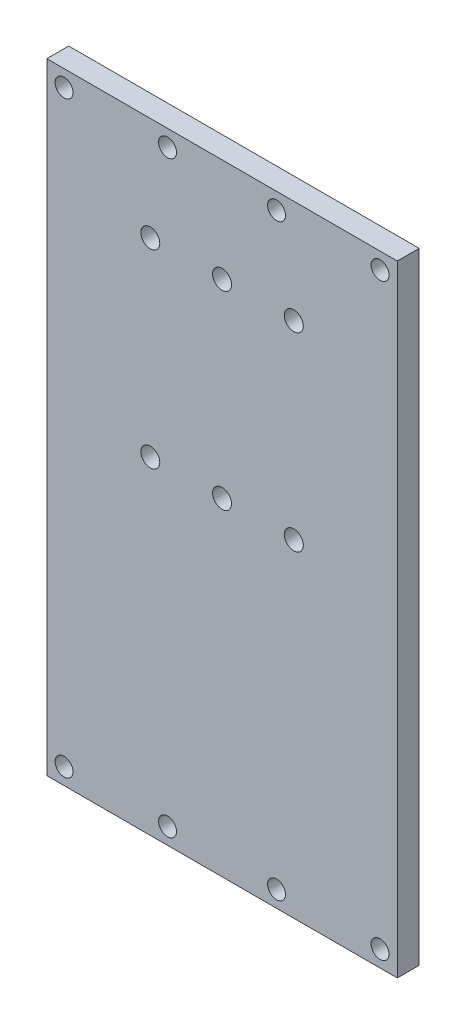
from build123d import *

# Parameters (mm, degrees)
ESBO_O1_W                = 101.6
ESBO_O1_H                = 180
RESSALTO_EXTRUS_O1_DEPTH = 6.35
CORTE_EXTRUS_O1_REACH    = 105.542
ESBO_O2_R                = 2.6
ESBO_O2_R_2              = 2.75


with BuildPart() as part:
    # Esboço1 → Ressalto-extrusão1 (new body)
    with BuildSketch(Plane.XY):
        Rectangle(ESBO_O1_W, ESBO_O1_H)
    extrude(amount=RESSALTO_EXTRUS_O1_DEPTH)

    # Esboço2 → Corte-extrusão1 (cut, up to next)
    with BuildSketch(Plane.XY.offset(6.35), mode=Mode.PRIVATE) as corte_extrus_o1_sk1:
        with Locations((-45.8, 85.24)):
            Circle(ESBO_O2_R)
    corte_extrus_o1_tool1 = extrude(corte_extrus_o1_sk1.sketch, amount=-CORTE_EXTRUS_O1_REACH, mode=Mode.PRIVATE) & part.part
    # Esboço2 → Corte-extrusão1 (cut, up to next)
    with BuildSketch(Plane.XY.offset(6.35), mode=Mode.PRIVATE) as corte_extrus_o1_sk2:
        with Locations((-15.8, 85.24)):
            Circle(ESBO_O2_R)
    corte_extrus_o1_tool2 = extrude(corte_extrus_o1_sk2.sketch, amount=-CORTE_EXTRUS_O1_REACH, mode=Mode.PRIVATE) & part.part
    # Esboço2 → Corte-extrusão1 (cut, up to next)
    with BuildSketch(Plane.XY.offset(6.35), mode=Mode.PRIVATE) as corte_extrus_o1_sk3:
        with Locations((15.8, 85.24)):
            Circle(ESBO_O2_R)
    corte_extrus_o1_tool3 = extrude(corte_extrus_o1_sk3.sketch, amount=-CORTE_EXTRUS_O1_REACH, mode=Mode.PRIVATE) & part.part
    # Esboço2 → Corte-extrusão1 (cut, up to next)
    with BuildSketch(Plane.XY.offset(6.35), mode=Mode.PRIVATE) as corte_extrus_o1_sk4:
        with Locations((45.8, 85.24)):
            Circle(ESBO_O2_R)
    corte_extrus_o1_tool4 = extrude(corte_extrus_o1_sk4.sketch, amount=-CORTE_EXTRUS_O1_REACH, mode=Mode.PRIVATE) & part.part
    # Esboço2 → Corte-extrusão1 (cut, up to next)
    with BuildSketch(Plane.XY.offset(6.35), mode=Mode.PRIVATE) as corte_extrus_o1_sk5:
        with Locations((45.8, -85.24)):
            Circle(ESBO_O2_R)
    corte_extrus_o1_tool5 = extrude(corte_extrus_o1_sk5.sketch, amount=-CORTE_EXTRUS_O1_REACH, mode=Mode.PRIVATE) & part.part
    # Esboço2 → Corte-extrusão1 (cut, up to next)
    with BuildSketch(Plane.XY.offset(6.35), mode=Mode.PRIVATE) as corte_extrus_o1_sk6:
        with Locations((15.8, -85.24)):
            Circle(ESBO_O2_R)
    corte_extrus_o1_tool6 = extrude(corte_extrus_o1_sk6.sketch, amount=-CORTE_EXTRUS_O1_REACH, mode=Mode.PRIVATE) & part.part
    # Esboço2 → Corte-extrusão1 (cut, up to next)
    with BuildSketch(Plane.XY.offset(6.35), mode=Mode.PRIVATE) as corte_extrus_o1_sk7:
        with Locations((-15.8, -85.24)):
            Circle(ESBO_O2_R)
    corte_extrus_o1_tool7 = extrude(corte_extrus_o1_sk7.sketch, amount=-CORTE_EXTRUS_O1_REACH, mode=Mode.PRIVATE) & part.part
    # Esboço2 → Corte-extrusão1 (cut, up to next)
    with BuildSketch(Plane.XY.offset(6.35), mode=Mode.PRIVATE) as corte_extrus_o1_sk8:
        with Locations((-45.8, -85.24)):
            Circle(ESBO_O2_R)
    corte_extrus_o1_tool8 = extrude(corte_extrus_o1_sk8.sketch, amount=-CORTE_EXTRUS_O1_REACH, mode=Mode.PRIVATE) & part.part
    # Esboço2 → Corte-extrusão1 (cut, up to next)
    with BuildSketch(Plane.XY.offset(6.35), mode=Mode.PRIVATE) as corte_extrus_o1_sk9:
        with Locations((20.8, 60)):
            Circle(ESBO_O2_R_2)
    corte_extrus_o1_tool9 = extrude(corte_extrus_o1_sk9.sketch, amount=-CORTE_EXTRUS_O1_REACH, mode=Mode.PRIVATE) & part.part
    # Esboço2 → Corte-extrusão1 (cut, up to next)
    with BuildSketch(Plane.XY.offset(6.35), mode=Mode.PRIVATE) as corte_extrus_o1_sk10:
        with Locations((0, 60)):
            Circle(ESBO_O2_R_2)
    corte_extrus_o1_tool10 = extrude(corte_extrus_o1_sk10.sketch, amount=-CORTE_EXTRUS_O1_REACH, mode=Mode.PRIVATE) & part.part
    # Esboço2 → Corte-extrusão1 (cut, up to next)
    with BuildSketch(Plane.XY.offset(6.35), mode=Mode.PRIVATE) as corte_extrus_o1_sk11:
        with Locations((-20.8, 60)):
            Circle(ESBO_O2_R_2)
    corte_extrus_o1_tool11 = extrude(corte_extrus_o1_sk11.sketch, amount=-CORTE_EXTRUS_O1_REACH, mode=Mode.PRIVATE) & part.part
    # Esboço2 → Corte-extrusão1 (cut, up to next)
    with BuildSketch(Plane.XY.offset(6.35), mode=Mode.PRIVATE) as corte_extrus_o1_sk12:
        with Locations((20.8, 5)):
            Circle(ESBO_O2_R_2)
    corte_extrus_o1_tool12 = extrude(corte_extrus_o1_sk12.sketch, amount=-CORTE_EXTRUS_O1_REACH, mode=Mode.PRIVATE) & part.part
    # Esboço2 → Corte-extrusão1 (cut, up to next)
    with BuildSketch(Plane.XY.offset(6.35), mode=Mode.PRIVATE) as corte_extrus_o1_sk13:
        with Locations((0, 5)):
            Circle(ESBO_O2_R_2)
    corte_extrus_o1_tool13 = extrude(corte_extrus_o1_sk13.sketch, amount=-CORTE_EXTRUS_O1_REACH, mode=Mode.PRIVATE) & part.part
    # Esboço2 → Corte-extrusão1 (cut, up to next)
    with BuildSketch(Plane.XY.offset(6.35), mode=Mode.PRIVATE) as corte_extrus_o1_sk14:
        with Locations((-20.8, 5)):
            Circle(ESBO_O2_R_2)
    corte_extrus_o1_tool14 = extrude(corte_extrus_o1_sk14.sketch, amount=-CORTE_EXTRUS_O1_REACH, mode=Mode.PRIVATE) & part.part
    add(corte_extrus_o1_tool1.solids().sort_by_distance((-45.8, 85.24, 6.35))[0], mode=Mode.SUBTRACT)
    add(corte_extrus_o1_tool2.solids().sort_by_distance((-15.8, 85.24, 6.35))[0], mode=Mode.SUBTRACT)
    add(corte_extrus_o1_tool3.solids().sort_by_distance((15.8, 85.24, 6.35))[0], mode=Mode.SUBTRACT)
    add(corte_extrus_o1_tool4.solids().sort_by_distance((45.8, 85.24, 6.35))[0], mode=Mode.SUBTRACT)
    add(corte_extrus_o1_tool5.solids().sort_by_distance((45.8, -85.24, 6.35))[0], mode=Mode.SUBTRACT)
    add(corte_extrus_o1_tool6.solids().sort_by_distance((15.8, -85.24, 6.35))[0], mode=Mode.SUBTRACT)
    add(corte_extrus_o1_tool7.solids().sort_by_distance((-15.8, -85.24, 6.35))[0], mode=Mode.SUBTRACT)
    add(corte_extrus_o1_tool8.solids().sort_by_distance((-45.8, -85.24, 6.35))[0], mode=Mode.SUBTRACT)
    add(corte_extrus_o1_tool9.solids().sort_by_distance((20.8, 60, 6.35))[0], mode=Mode.SUBTRACT)
    add(corte_extrus_o1_tool10.solids().sort_by_distance((0, 60, 6.35))[0], mode=Mode.SUBTRACT)
    add(corte_extrus_o1_tool11.solids().sort_by_distance((-20.8, 60, 6.35))[0], mode=Mode.SUBTRACT)
    add(corte_extrus_o1_tool12.solids().sort_by_distance((20.8, 5, 6.35))[0], mode=Mode.SUBTRACT)
    add(corte_extrus_o1_tool13.solids().sort_by_distance((0, 5, 6.35))[0], mode=Mode.SUBTRACT)
    add(corte_extrus_o1_tool14.solids().sort_by_distance((-20.8, 5, 6.35))[0], mode=Mode.SUBTRACT)


solid = part.part
